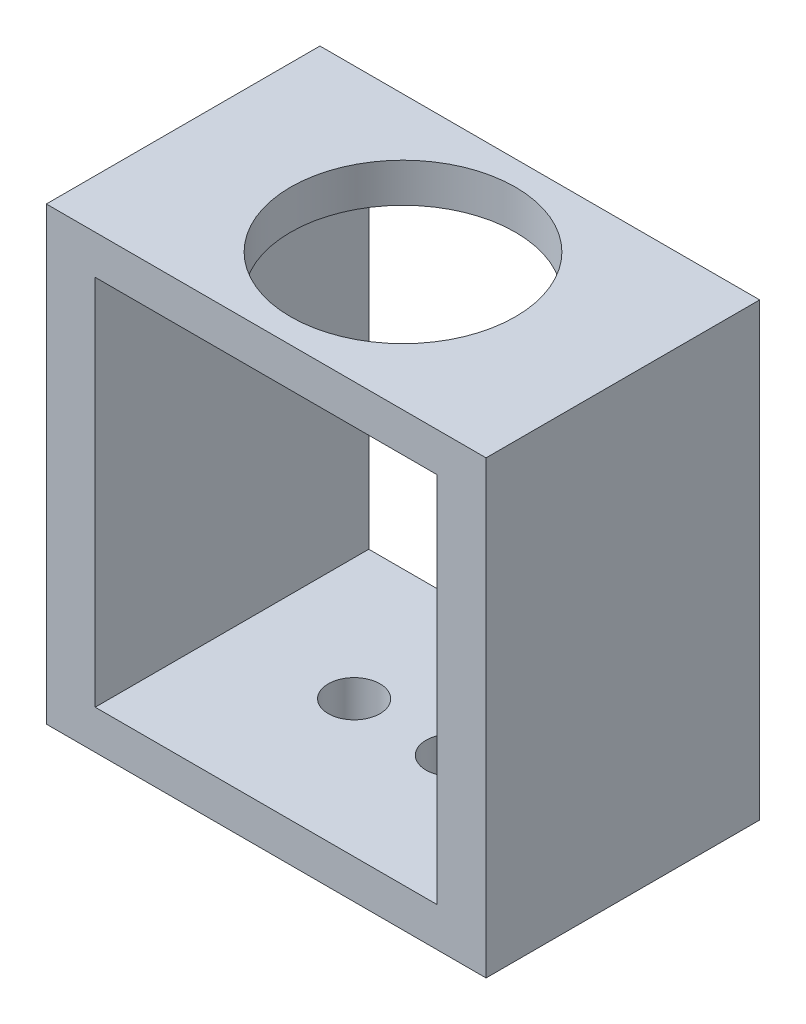
from build123d import *

# Parameters (mm, degrees)
SKETCH1_W           = 35
SKETCH1_H           = 28
SKETCH1_R           = 2.65
BOSS_EXTRUDE1_DEPTH = 4
SKETCH2_W           = 5
SKETCH2_H           = 28
BOSS_EXTRUDE2_DEPTH = 42.1
SKETCH3_W           = 45
SKETCH3_H           = 28
SKETCH3_R           = 11.5
BOSS_EXTRUDE3_DEPTH = 4


with BuildPart() as part:
    # Sketch1 → Boss-Extrude1 (new body)
    with BuildSketch(Plane(origin=(0, 0, 0), x_dir=(1, 0, 0), z_dir=(0, 1, 0))):
        with Locations((17.5, 14)):
            Rectangle(SKETCH1_W, SKETCH1_H)
        with Locations(Location((12.5, 14, 0), (0, 0, 270))):
            Circle(SKETCH1_R, mode=Mode.SUBTRACT)
        with Locations(Location((22.5, 14, 0), (0, 0, 270))):
            Circle(SKETCH1_R, mode=Mode.SUBTRACT)
    extrude(amount=BOSS_EXTRUDE1_DEPTH)

    # Sketch2 → Boss-Extrude2 (add)
    with BuildSketch(Plane.XZ):
        with Locations((-2.5, -14)):
            Rectangle(SKETCH2_W, SKETCH2_H)
        with Locations((37.5, -14)):
            Rectangle(SKETCH2_W, SKETCH2_H)
    extrude(amount=-BOSS_EXTRUDE2_DEPTH)

    # Sketch3 → Boss-Extrude3 (add)
    with BuildSketch(Plane(origin=(0, 42.1, 0), x_dir=(1, 0, 0), z_dir=(0, 1, 0))):
        with Locations((17.5, 14)):
            Rectangle(SKETCH3_W, SKETCH3_H)
        with Locations(Location((17.5, 14, 0), (0, 0, 270))):
            Circle(SKETCH3_R, mode=Mode.SUBTRACT)
    extrude(amount=BOSS_EXTRUDE3_DEPTH)


solid = part.part
